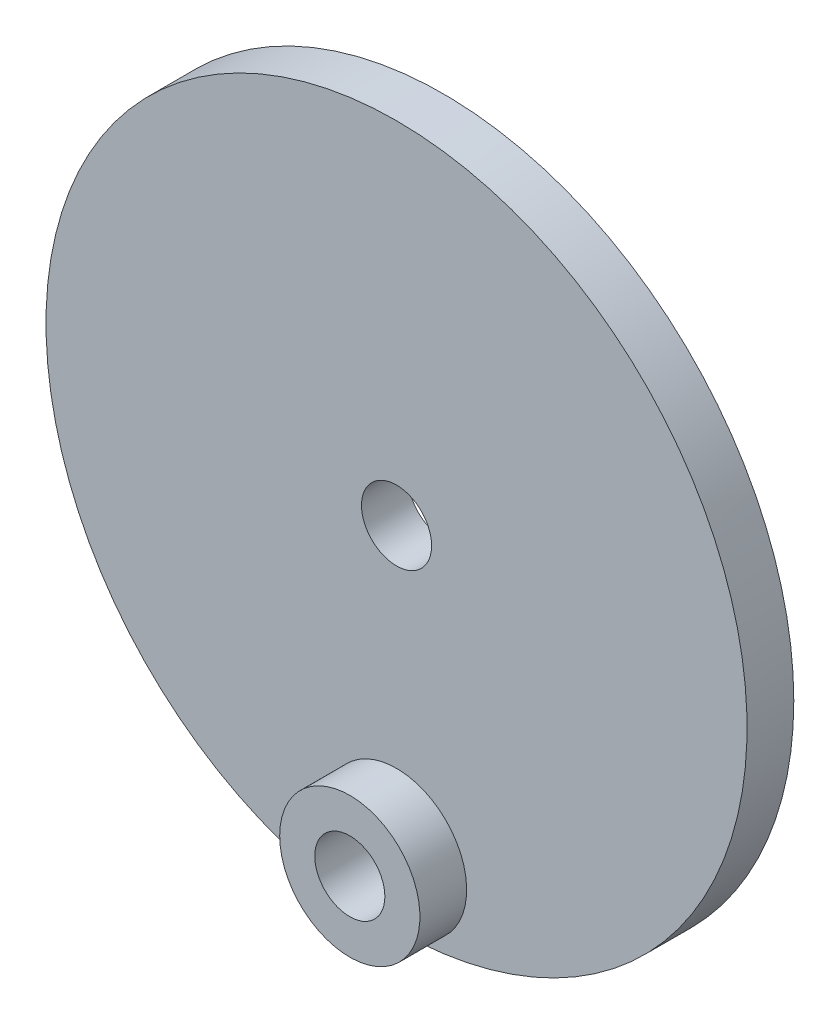
from build123d import *

# Parameters (mm, degrees)
ESQUISSE1_R             = 15
BOSS_EXTRU_1_DEPTH      = 2
ESQUISSE2_R             = 1.5
ENL_V_MAT_EXTRU_1_DEPTH = 3
ESQUISSE3_R             = 1.5
ENL_V_MAT_EXTRU_2_DEPTH = 3
BOSS_EXTRU_2_START      = -4
ESQUISSE4_R             = 3
ESQUISSE4_R_2           = 1.5
BOSS_EXTRU_2_DEPTH      = 4


with BuildPart() as part:
    # Esquisse1 → Boss.-Extru.1 (new body)
    with BuildSketch(Plane.XY):
        Circle(ESQUISSE1_R)
    extrude(amount=BOSS_EXTRU_1_DEPTH)

    # Esquisse2 → Enlèv. mat.-Extru.1 (cut)
    with BuildSketch(Plane.XY.offset(2)):
        Circle(ESQUISSE2_R)
    extrude(amount=-ENL_V_MAT_EXTRU_1_DEPTH, mode=Mode.SUBTRACT)

    # Esquisse3 → Enlèv. mat.-Extru.2 (cut)
    with BuildSketch(Plane.XY.offset(2)):
        with Locations((0, -12)):
            Circle(ESQUISSE3_R)
    extrude(amount=-ENL_V_MAT_EXTRU_2_DEPTH, mode=Mode.SUBTRACT)

    # Esquisse4 → Boss.-Extru.2 (add)
    with BuildSketch(Plane(origin=(0, 0, 0), x_dir=(-1, 0, 0), z_dir=(0, 0, -1)).offset(BOSS_EXTRU_2_START)):
        with Locations((0, -12)):
            Circle(ESQUISSE4_R)
        with Locations(Location((0, -12, 0), (0, 0, 180))):
            Circle(ESQUISSE4_R_2, mode=Mode.SUBTRACT)
    extrude(amount=BOSS_EXTRU_2_DEPTH)


solid = part.part
